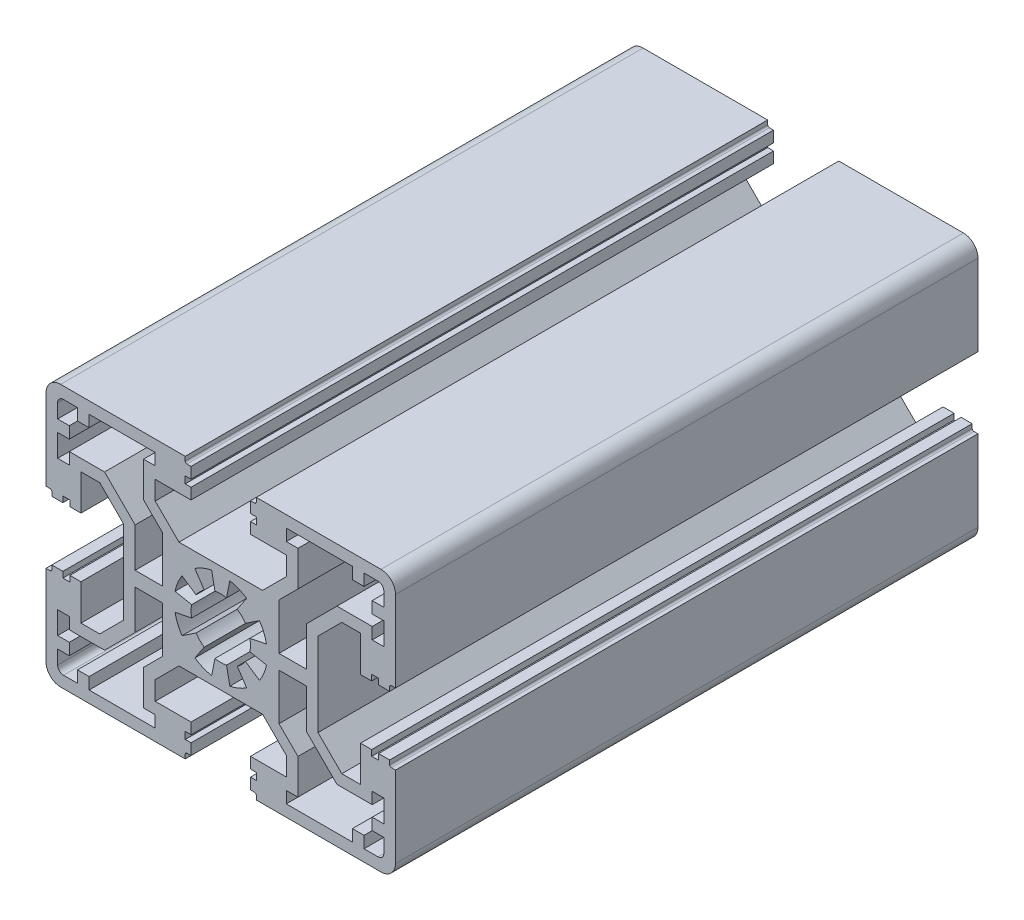
from build123d import *

# Parameters (mm, degrees)
EXTRUDE_1_DEPTH = 100


with BuildPart() as part:
    # 草图1 → 凸台-拉伸1 (new body)
    with BuildSketch(Plane.XY):
        with BuildLine():
            Line((-5.977197952, 23.257012623), (-27.377197952, 23.257012623))
            ThreePointArc((-27.377197952, 23.257012623), (-29.144964905, 22.524779576), (-29.877197952, 20.757012623))
            Line((-29.877197952, 20.757012623), (-29.877197952, 6.857012623))
            Line((-29.877197952, 6.857012623), (-29.177197952, 6.857012623))
            ThreePointArc((-29.177197952, 6.857012623), (-28.965065918, 6.769144657), (-28.877197952, 6.557012623))
            Line((-28.877197952, 6.557012623), (-28.877197952, 5.857012623))
            Line((-28.877197952, 5.857012623), (-26.977197952, 5.857012623))
            Line((-26.977197952, 5.857012623), (-26.977197952, 6.857012623))
            Line((-26.977197952, 6.857012623), (-25.777197952, 6.857012623))
            Line((-25.777197952, 6.857012623), (-25.777197952, 5.857012623))
            Line((-25.777197952, 5.857012623), (-23.877197952, 5.857012623))
            Line((-23.877197952, 5.857012623), (-23.877197952, 12.007012623))
            Line((-23.877197952, 12.007012623), (-20.655625077, 12.007012623))
            Line((-20.655625077, 12.007012623), (-16.577197952, 7.928585498))
            Line((-16.577197952, 7.928585498), (-16.577197952, 0.757012623))
            Line((-16.577197952, 0.757012623), (-16.577197952, -6.414560253))
            Line((-16.577197952, -6.414560253), (-20.655625077, -10.492987377))
            Line((-20.655625077, -10.492987377), (-23.877197952, -10.492987377))
            Line((-23.877197952, -10.492987377), (-23.877197952, -4.342987377))
            Line((-23.877197952, -4.342987377), (-25.777197952, -4.342987377))
            Line((-25.777197952, -4.342987377), (-25.777197952, -5.342987377))
            Line((-25.777197952, -5.342987377), (-26.977197952, -5.342987377))
            Line((-26.977197952, -5.342987377), (-26.977197952, -4.342987377))
            Line((-26.977197952, -4.342987377), (-28.877197952, -4.342987377))
            Line((-28.877197952, -4.342987377), (-28.877197952, -5.042987377))
            ThreePointArc((-28.877197952, -5.042987377), (-28.965065918, -5.255119412), (-29.177197952, -5.342987377))
            Line((-29.177197952, -5.342987377), (-29.877197952, -5.342987377))
            Line((-29.877197952, -5.342987377), (-29.877197952, -19.242987377))
            ThreePointArc((-29.877197952, -19.242987377), (-29.144964905, -21.01075433), (-27.377197952, -21.742987377))
            Line((-27.377197952, -21.742987377), (-5.977197952, -21.742987377))
            Line((-5.977197952, -21.742987377), (-5.977197952, -21.042987377))
            ThreePointArc((-5.977197952, -21.042987377), (-5.889329987, -20.830855343), (-5.677197952, -20.742987377))
            Line((-5.677197952, -20.742987377), (-4.977197952, -20.742987377))
            Line((-4.977197952, -20.742987377), (-4.977197952, -18.842987377))
            Line((-4.977197952, -18.842987377), (-5.977197952, -18.842987377))
            Line((-5.977197952, -18.842987377), (-5.977197952, -17.642987377))
            Line((-5.977197952, -17.642987377), (-4.977197952, -17.642987377))
            Line((-4.977197952, -17.642987377), (-4.977197952, -15.742987377))
            Line((-4.977197952, -15.742987377), (-11.127197952, -15.742987377))
            Line((-11.127197952, -15.742987377), (-11.127197952, -12.521414502))
            Line((-11.127197952, -12.521414502), (-7.048770828, -8.442987377))
            Line((-7.048770828, -8.442987377), (7.294374923, -8.442987377))
            Line((7.294374923, -8.442987377), (11.372802048, -12.521414502))
            Line((11.372802048, -12.521414502), (11.372802048, -15.742987377))
            Line((11.372802048, -15.742987377), (5.222802048, -15.742987377))
            Line((5.222802048, -15.742987377), (5.222802048, -17.642987377))
            Line((5.222802048, -17.642987377), (6.222802048, -17.642987377))
            Line((6.222802048, -17.642987377), (6.222802048, -18.842987377))
            Line((6.222802048, -18.842987377), (5.222802048, -18.842987377))
            Line((5.222802048, -18.842987377), (5.222802048, -20.742987377))
            Line((5.222802048, -20.742987377), (5.922802048, -20.742987377))
            ThreePointArc((5.922802048, -20.742987377), (6.134934082, -20.830855343), (6.222802048, -21.042987377))
            Line((6.222802048, -21.042987377), (6.222802048, -21.742987377))
            Line((6.222802048, -21.742987377), (27.622802048, -21.742987377))
            ThreePointArc((27.622802048, -21.742987377), (29.390569001, -21.01075433), (30.122802048, -19.242987377))
            Line((30.122802048, -19.242987377), (30.122802048, -5.342987377))
            Line((30.122802048, -5.342987377), (29.422802048, -5.342987377))
            ThreePointArc((29.422802048, -5.342987377), (29.210670013, -5.255119412), (29.122802048, -5.042987377))
            Line((29.122802048, -5.042987377), (29.122802048, -4.342987377))
            Line((29.122802048, -4.342987377), (27.222802048, -4.342987377))
            Line((27.222802048, -4.342987377), (27.222802048, -5.342987377))
            Line((27.222802048, -5.342987377), (26.022802048, -5.342987377))
            Line((26.022802048, -5.342987377), (26.022802048, -4.342987377))
            Line((26.022802048, -4.342987377), (24.122802048, -4.342987377))
            Line((24.122802048, -4.342987377), (24.122802048, -10.492987377))
            Line((24.122802048, -10.492987377), (20.901229172, -10.492987377))
            Line((20.901229172, -10.492987377), (16.822802048, -6.414560253))
            Line((16.822802048, -6.414560253), (16.822802048, 0.757012623))
            Line((16.822802048, 0.757012623), (16.822802048, 7.928585498))
            Line((16.822802048, 7.928585498), (20.901229172, 12.007012623))
            Line((20.901229172, 12.007012623), (24.122802048, 12.007012623))
            Line((24.122802048, 12.007012623), (24.122802048, 5.857012623))
            Line((24.122802048, 5.857012623), (26.022802048, 5.857012623))
            Line((26.022802048, 5.857012623), (26.022802048, 6.857012623))
            Line((26.022802048, 6.857012623), (27.222802048, 6.857012623))
            Line((27.222802048, 6.857012623), (27.222802048, 5.857012623))
            Line((27.222802048, 5.857012623), (29.122802048, 5.857012623))
            Line((29.122802048, 5.857012623), (29.122802048, 6.557012623))
            ThreePointArc((29.122802048, 6.557012623), (29.210670013, 6.769144657), (29.422802048, 6.857012623))
            Line((29.422802048, 6.857012623), (30.122802048, 6.857012623))
            Line((30.122802048, 6.857012623), (30.122802048, 20.757012623))
            ThreePointArc((30.122802048, 20.757012623), (29.390569001, 22.524779576), (27.622802048, 23.257012623))
            Line((27.622802048, 23.257012623), (6.222802048, 23.257012623))
            Line((6.222802048, 23.257012623), (6.222802048, 22.557012623))
            ThreePointArc((6.222802048, 22.557012623), (6.134934082, 22.344880588), (5.922802048, 22.257012623))
            Line((5.922802048, 22.257012623), (5.222802048, 22.257012623))
            Line((5.222802048, 22.257012623), (5.222802048, 20.357012623))
            Line((5.222802048, 20.357012623), (6.222802048, 20.357012623))
            Line((6.222802048, 20.357012623), (6.222802048, 19.157012623))
            Line((6.222802048, 19.157012623), (5.222802048, 19.157012623))
            Line((5.222802048, 19.157012623), (5.222802048, 17.257012623))
            Line((5.222802048, 17.257012623), (11.372802048, 17.257012623))
            Line((11.372802048, 17.257012623), (11.372802048, 14.035439747))
            Line((11.372802048, 14.035439747), (7.294374923, 9.957012623))
            Line((7.294374923, 9.957012623), (-7.048770828, 9.957012623))
            Line((-7.048770828, 9.957012623), (-11.127197952, 14.035439747))
            Line((-11.127197952, 14.035439747), (-11.127197952, 17.257012623))
            Line((-11.127197952, 17.257012623), (-4.977197952, 17.257012623))
            Line((-4.977197952, 17.257012623), (-4.977197952, 19.157012623))
            Line((-4.977197952, 19.157012623), (-5.977197952, 19.157012623))
            Line((-5.977197952, 19.157012623), (-5.977197952, 20.357012623))
            Line((-5.977197952, 20.357012623), (-4.977197952, 20.357012623))
            Line((-4.977197952, 20.357012623), (-4.977197952, 22.257012623))
            Line((-4.977197952, 22.257012623), (-5.677197952, 22.257012623))
            ThreePointArc((-5.677197952, 22.257012623), (-5.889329987, 22.344880588), (-5.977197952, 22.557012623))
            Line((-5.977197952, 22.557012623), (-5.977197952, 23.257012623))
        make_face()
        with BuildLine():
            Line((-14.577197952, 8.757012623), (-14.577197952, 2.007012623))
            Line((-14.577197952, 2.007012623), (-9.877197952, 2.007012623))
            Line((-9.877197952, 2.007012623), (-9.877197952, 9.957012623))
            Line((-9.877197952, 9.957012623), (-13.127197952, 13.207012623))
            Line((-13.127197952, 13.207012623), (-13.127197952, 19.257012623))
            Line((-13.127197952, 19.257012623), (-11.127197952, 19.257012623))
            Line((-11.127197952, 19.257012623), (-11.127197952, 21.257012623))
            Line((-11.127197952, 21.257012623), (-13.127197952, 21.257012623))
            Line((-13.127197952, 21.257012623), (-14.127197952, 21.257012623))
            Line((-14.127197952, 21.257012623), (-22.477800671, 21.257012623))
            Line((-22.477800671, 21.257012623), (-22.477800671, 19.257012623))
            Line((-22.477800671, 19.257012623), (-24.477800671, 19.257012623))
            Line((-24.477800671, 19.257012623), (-24.477800671, 21.257012623))
            Line((-24.477800671, 21.257012623), (-26.877197952, 21.257012623))
            ThreePointArc((-26.877197952, 21.257012623), (-27.584304734, 20.964119404), (-27.877197952, 20.257012623))
            Line((-27.877197952, 20.257012623), (-27.877197952, 17.857615342))
            Line((-27.877197952, 17.857615342), (-25.877197952, 17.857615342))
            Line((-25.877197952, 17.857615342), (-25.877197952, 15.857615342))
            Line((-25.877197952, 15.857615342), (-27.877197952, 15.857615342))
            Line((-27.877197952, 15.857615342), (-27.877197952, 15.007012623))
            Line((-27.877197952, 15.007012623), (-27.877197952, 14.007012623))
            Line((-27.877197952, 14.007012623), (-27.877197952, 12.007012623))
            Line((-27.877197952, 12.007012623), (-25.877197952, 12.007012623))
            Line((-25.877197952, 12.007012623), (-25.877197952, 14.007012623))
            Line((-25.877197952, 14.007012623), (-19.827197952, 14.007012623))
            Line((-19.827197952, 14.007012623), (-14.577197952, 8.757012623))
        make_face(mode=Mode.SUBTRACT)
        with BuildLine():
            Line((6.774558946, 5.201574487), (4.36329707, 3.590420811))
            ThreePointArc((4.36329707, 3.590420811), (3.729046632, 4.363257207), (2.956210236, 4.997507645))
            Line((2.956210236, 4.997507645), (4.567363912, 7.408769521))
            ThreePointArc((4.567363912, 7.408769521), (3.184269507, 8.148048883), (1.683524624, 8.603294866))
            Line((1.683524624, 8.603294866), (1.11776269, 5.759017553))
            ThreePointArc((1.11776269, 5.759017553), (0.122802048, 5.857012623), (-0.872158595, 5.759017553))
            Line((-0.872158595, 5.759017553), (-1.437920528, 8.603294866))
            ThreePointArc((-1.437920528, 8.603294866), (-2.938665411, 8.148048883), (-4.321759817, 7.408769521))
            Line((-4.321759817, 7.408769521), (-2.710606141, 4.997507645))
            ThreePointArc((-2.710606141, 4.997507645), (-3.483442536, 4.363257207), (-4.117692975, 3.590420811))
            Line((-4.117692975, 3.590420811), (-6.528954851, 5.201574487))
            ThreePointArc((-6.528954851, 5.201574487), (-7.268234212, 3.818480082), (-7.723480196, 2.317735199))
            Line((-7.723480196, 2.317735199), (-4.879202882, 1.751973265))
            ThreePointArc((-4.879202882, 1.751973265), (-4.977197952, 0.757012623), (-4.879202882, -0.23794802))
            Line((-4.879202882, -0.23794802), (-7.723480196, -0.803709953))
            ThreePointArc((-7.723480196, -0.803709953), (-7.268234212, -2.304454836), (-6.528954851, -3.687549241))
            Line((-6.528954851, -3.687549241), (-4.117692975, -2.076395566))
            ThreePointArc((-4.117692975, -2.076395566), (-3.483442536, -2.849231961), (-2.710606141, -3.4834824))
            Line((-2.710606141, -3.4834824), (-4.321759817, -5.894744276))
            ThreePointArc((-4.321759817, -5.894744276), (-2.938665411, -6.634023637), (-1.437920528, -7.089269621))
            Line((-1.437920528, -7.089269621), (-0.872158595, -4.244992307))
            ThreePointArc((-0.872158595, -4.244992307), (0.122802048, -4.342987377), (1.11776269, -4.244992307))
            Line((1.11776269, -4.244992307), (1.683524624, -7.089269621))
            ThreePointArc((1.683524624, -7.089269621), (3.184269507, -6.634023637), (4.567363912, -5.894744276))
            Line((4.567363912, -5.894744276), (2.956210236, -3.4834824))
            ThreePointArc((2.956210236, -3.4834824), (3.729046632, -2.849231961), (4.36329707, -2.076395566))
            Line((4.36329707, -2.076395566), (6.774558946, -3.687549241))
            ThreePointArc((6.774558946, -3.687549241), (7.513838308, -2.304454836), (7.969084291, -0.803709953))
            Line((7.969084291, -0.803709953), (5.124806978, -0.23794802))
            ThreePointArc((5.124806978, -0.23794802), (5.222802048, 0.757012623), (5.124806978, 1.751973265))
            Line((5.124806978, 1.751973265), (7.969084291, 2.317735199))
            ThreePointArc((7.969084291, 2.317735199), (7.513838308, 3.818480082), (6.774558946, 5.201574487))
        make_face(mode=Mode.SUBTRACT)
        with BuildLine():
            Line((13.372802048, 19.257012623), (11.372802048, 19.257012623))
            Line((11.372802048, 19.257012623), (11.372802048, 21.257012623))
            Line((11.372802048, 21.257012623), (13.372802048, 21.257012623))
            Line((13.372802048, 21.257012623), (14.372802048, 21.257012623))
            Line((14.372802048, 21.257012623), (22.723404767, 21.257012623))
            Line((22.723404767, 21.257012623), (22.723404767, 19.257012623))
            Line((22.723404767, 19.257012623), (24.723404767, 19.257012623))
            Line((24.723404767, 19.257012623), (24.723404767, 21.257012623))
            Line((24.723404767, 21.257012623), (27.122802048, 21.257012623))
            ThreePointArc((27.122802048, 21.257012623), (27.829908829, 20.964119404), (28.122802048, 20.257012623))
            Line((28.122802048, 20.257012623), (28.122802048, 17.857615342))
            Line((28.122802048, 17.857615342), (26.122802048, 17.857615342))
            Line((26.122802048, 17.857615342), (26.122802048, 15.857615342))
            Line((26.122802048, 15.857615342), (28.122802048, 15.857615342))
            Line((28.122802048, 15.857615342), (28.122802048, 15.007012623))
            Line((28.122802048, 15.007012623), (28.122802048, 14.007012623))
            Line((28.122802048, 14.007012623), (28.122802048, 12.007012623))
            Line((28.122802048, 12.007012623), (26.122802048, 12.007012623))
            Line((26.122802048, 12.007012623), (26.122802048, 14.007012623))
            Line((26.122802048, 14.007012623), (20.072802048, 14.007012623))
            Line((20.072802048, 14.007012623), (14.822802048, 8.757012623))
            Line((14.822802048, 8.757012623), (14.822802048, 2.007012623))
            Line((14.822802048, 2.007012623), (10.122802048, 2.007012623))
            Line((10.122802048, 2.007012623), (10.122802048, 9.957012623))
            Line((10.122802048, 9.957012623), (13.372802048, 13.207012623))
            Line((13.372802048, 13.207012623), (13.372802048, 19.257012623))
        make_face(mode=Mode.SUBTRACT)
        with BuildLine():
            Line((-13.127197952, -17.742987377), (-11.127197952, -17.742987377))
            Line((-11.127197952, -17.742987377), (-11.127197952, -19.742987377))
            Line((-11.127197952, -19.742987377), (-13.127197952, -19.742987377))
            Line((-13.127197952, -19.742987377), (-14.127197952, -19.742987377))
            Line((-14.127197952, -19.742987377), (-22.477800671, -19.742987377))
            Line((-22.477800671, -19.742987377), (-22.477800671, -17.742987377))
            Line((-22.477800671, -17.742987377), (-24.477800671, -17.742987377))
            Line((-24.477800671, -17.742987377), (-24.477800671, -19.742987377))
            Line((-24.477800671, -19.742987377), (-26.877197952, -19.742987377))
            ThreePointArc((-26.877197952, -19.742987377), (-27.584304734, -19.450094158), (-27.877197952, -18.742987377))
            Line((-27.877197952, -18.742987377), (-27.877197952, -16.343590096))
            Line((-27.877197952, -16.343590096), (-25.877197952, -16.343590096))
            Line((-25.877197952, -16.343590096), (-25.877197952, -14.343590096))
            Line((-25.877197952, -14.343590096), (-27.877197952, -14.343590096))
            Line((-27.877197952, -14.343590096), (-27.877197952, -13.492987377))
            Line((-27.877197952, -13.492987377), (-27.877197952, -12.492987377))
            Line((-27.877197952, -12.492987377), (-27.877197952, -10.492987377))
            Line((-27.877197952, -10.492987377), (-25.877197952, -10.492987377))
            Line((-25.877197952, -10.492987377), (-25.877197952, -12.492987377))
            Line((-25.877197952, -12.492987377), (-19.827197952, -12.492987377))
            Line((-19.827197952, -12.492987377), (-14.577197952, -7.242987377))
            Line((-14.577197952, -7.242987377), (-14.577197952, -0.492987377))
            Line((-14.577197952, -0.492987377), (-9.877197952, -0.492987377))
            Line((-9.877197952, -0.492987377), (-9.877197952, -8.442987377))
            Line((-9.877197952, -8.442987377), (-13.127197952, -11.692987377))
            Line((-13.127197952, -11.692987377), (-13.127197952, -17.742987377))
        make_face(mode=Mode.SUBTRACT)
        with BuildLine():
            Line((13.372802048, -17.742987377), (11.372802048, -17.742987377))
            Line((11.372802048, -17.742987377), (11.372802048, -19.742987377))
            Line((11.372802048, -19.742987377), (13.372802048, -19.742987377))
            Line((13.372802048, -19.742987377), (14.372802048, -19.742987377))
            Line((14.372802048, -19.742987377), (22.723404767, -19.742987377))
            Line((22.723404767, -19.742987377), (22.723404767, -17.742987377))
            Line((22.723404767, -17.742987377), (24.723404767, -17.742987377))
            Line((24.723404767, -17.742987377), (24.723404767, -19.742987377))
            Line((24.723404767, -19.742987377), (27.122802048, -19.742987377))
            ThreePointArc((27.122802048, -19.742987377), (27.829908829, -19.450094158), (28.122802048, -18.742987377))
            Line((28.122802048, -18.742987377), (28.122802048, -16.343590096))
            Line((28.122802048, -16.343590096), (26.122802048, -16.343590096))
            Line((26.122802048, -16.343590096), (26.122802048, -14.343590096))
            Line((26.122802048, -14.343590096), (28.122802048, -14.343590096))
            Line((28.122802048, -14.343590096), (28.122802048, -13.492987377))
            Line((28.122802048, -13.492987377), (28.122802048, -12.492987377))
            Line((28.122802048, -12.492987377), (28.122802048, -10.492987377))
            Line((28.122802048, -10.492987377), (26.122802048, -10.492987377))
            Line((26.122802048, -10.492987377), (26.122802048, -12.492987377))
            Line((26.122802048, -12.492987377), (20.072802048, -12.492987377))
            Line((20.072802048, -12.492987377), (14.822802048, -7.242987377))
            Line((14.822802048, -7.242987377), (14.822802048, -0.492987377))
            Line((14.822802048, -0.492987377), (10.122802048, -0.492987377))
            Line((10.122802048, -0.492987377), (10.122802048, -8.442987377))
            Line((10.122802048, -8.442987377), (13.372802048, -11.692987377))
            Line((13.372802048, -11.692987377), (13.372802048, -17.742987377))
        make_face(mode=Mode.SUBTRACT)
    extrude(amount=EXTRUDE_1_DEPTH)


solid = part.part
